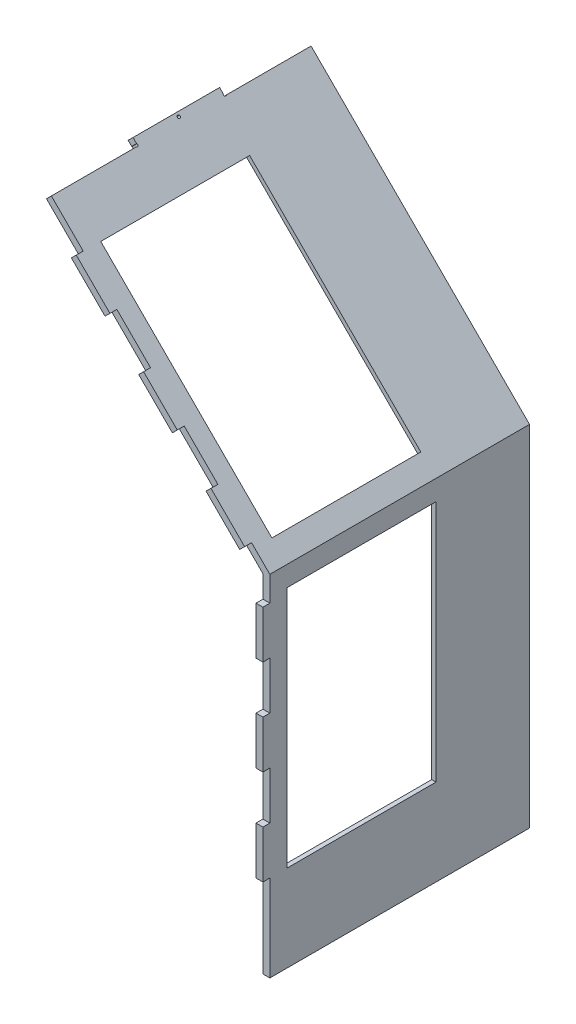
from build123d import *

# Parameters (mm, degrees)
BOSS_EXTRU_1_DEPTH      = 308
ESQUISSE2_W             = 8
ESQUISSE2_H             = 100
ESQUISSE2_H_2           = 55
ENL_V_MAT_EXTRU_1_DEPTH = 8
ESQUISSE3_W             = 172
ESQUISSE3_H             = 280.536291501
ENL_V_MAT_EXTRU_2_DEPTH = 532
ESQUISSE4_R             = 1.6
ESQUISSE4_W             = 172
ESQUISSE4_H             = 279.620784643
ENL_V_MAT_EXTRU_3_DEPTH = 8
ESQUISSE5_W             = 182
ESQUISSE5_H             = 290.536291501
ENL_V_MAT_EXTRU_4_DEPTH = 3
ESQUISSE6_W             = 182
ESQUISSE6_H             = 290
ENL_V_MAT_EXTRU_5_DEPTH = 3
ESQUISSE7_R             = 4
ENL_V_MAT_EXTRU_6_DEPTH = 5.3
ESQUISSE8_W             = 8.5
ESQUISSE8_H             = 406.733495256
ENL_V_MAT_EXTRU_7_DEPTH = 4
ESQUISSE9_W             = 8.5
ESQUISSE9_H             = 359.311541269
ENL_V_MAT_EXTRU_8_DEPTH = 4


with BuildPart() as part:
    # Esquisse1 → Boss.-Extru.1 (new body)
    with BuildSketch(Plane.XY):
        Polygon((-49.970813456, -41.917379116), (-57.970813456, -41.917379116), (-57.970813456, 358.618912385), (-313.627667703, 614.275766632), (-307.970813453, 619.932620882), (-49.970813456, 361.932620884), align=None)
    extrude(amount=BOSS_EXTRU_1_DEPTH)

    # Esquisse2 → Enlèv. mat.-Extru.1 (cut)
    with BuildSketch(Plane.XY.offset(308)):
        with Locations((-53.970813456, 8.082620884)):
            Rectangle(ESQUISSE2_W, ESQUISSE2_H)
        Polygon((-271.201260832, 571.849359761), (-265.544406582, 577.506214011), (-307.970813453, 619.932620882), (-313.627667703, 614.275766632), align=None)
        with Locations((-53.970813456, 140.582620884)):
            Rectangle(ESQUISSE2_W, ESQUISSE2_H_2)
        with Locations((-53.970813456, 250.582620884)):
            Rectangle(ESQUISSE2_W, ESQUISSE2_H_2)
        Polygon((-232.310387866, 532.958486796), (-226.653533617, 538.615341045), (-187.762660652, 499.72446808), (-193.419514901, 494.067613831), align=None)
        Polygon((-154.528641936, 455.176740865), (-148.871787686, 460.833595115), (-109.980914721, 421.94272215), (-115.637768971, 416.2858679), align=None)
        Polygon((-76.746896005, 377.394994935), (-71.090041756, 383.051849184), (-49.970813456, 361.932620884), (-49.970813456, 333.082620884), (-57.970813456, 333.082620884), (-57.970813456, 358.618912385), align=None)
    extrude(amount=-ENL_V_MAT_EXTRU_1_DEPTH, mode=Mode.SUBTRACT)

    # Esquisse3 → Enlèv. mat.-Extru.2 (cut)
    with BuildSketch(Plane.ZY.offset(57.970813456)):
        with Locations((194, 198.350766635)):
            Rectangle(ESQUISSE3_W, ESQUISSE3_H)
    extrude(amount=-ENL_V_MAT_EXTRU_2_DEPTH, mode=Mode.SUBTRACT)

    # Esquisse4 → Enlèv. mat.-Extru.3 (cut)
    with BuildSketch(Plane(origin=(155.980903714, 155.980903714, 0), x_dir=(0, 0, -1), z_dir=(0.707106781186556, 0.7071067811865391, 0))):
        with Locations(Location((-150, 652.126810705, 0), (0, 0, 90))):
            Circle(ESQUISSE4_R)
        with BuildLine():
            Line((-202.2627417, 648.126810705), (-300, 648.126810705))
            Line((-300, 648.126810705), (-300, 656.126810705))
            Line((-300, 656.126810705), (-200, 656.126810705))
            Line((-200, 656.126810705), (-200, 650.389552405))
            ThreePointArc((-200, 650.389552405), (-200, 648.126810705), (-202.2627417, 648.126810705))
        make_face()
        with BuildLine():
            Line((-100, 656.126810705), (-100, 650.389552405))
            ThreePointArc((-100, 650.389552405), (-100, 648.126810705), (-97.7372583, 648.126810705))
            Line((-97.7372583, 648.126810705), (0, 648.126810705))
            Line((0, 648.126810705), (0, 656.126810705))
            Line((0, 656.126810705), (-100, 656.126810705))
        make_face()
        with Locations((-194, 455.937203027)):
            Rectangle(ESQUISSE4_W, ESQUISSE4_H)
    extrude(amount=-ENL_V_MAT_EXTRU_3_DEPTH, mode=Mode.SUBTRACT)

    # Esquisse5 → Enlèv. mat.-Extru.4 (cut)
    with BuildSketch(Plane.ZY.offset(57.970813456)):
        with Locations((194, 198.350766635)):
            Rectangle(ESQUISSE5_W, ESQUISSE5_H)
    extrude(amount=-ENL_V_MAT_EXTRU_4_DEPTH, mode=Mode.SUBTRACT)

    # Esquisse6 → Enlèv. mat.-Extru.5 (cut)
    with BuildSketch(Plane(origin=(150.324049465, 150.324049465, 0), x_dir=(0, 0, 1), z_dir=(-0.707106781186556, -0.7071067811865391, 0))):
        with Locations((194, 455.747595348)):
            Rectangle(ESQUISSE6_W, ESQUISSE6_H)
    extrude(amount=-ENL_V_MAT_EXTRU_5_DEPTH, mode=Mode.SUBTRACT)

    # Esquisse7 → Enlèv. mat.-Extru.6 (cut)
    with BuildSketch(Plane.ZY.offset(57.970813456)):
        with Locations((20, -21.917379116)):
            Circle(ESQUISSE7_R)
    extrude(amount=-ENL_V_MAT_EXTRU_6_DEPTH, mode=Mode.SUBTRACT)

    # Esquisse8 → Enlèv. mat.-Extru.7 (cut)
    with BuildSketch(Plane.ZY.offset(57.970813456)):
        with Locations((94.25, 157.026144561)):
            Rectangle(ESQUISSE8_W, ESQUISSE8_H)
    extrude(amount=-ENL_V_MAT_EXTRU_7_DEPTH, mode=Mode.SUBTRACT)

    # Esquisse9 → Enlèv. mat.-Extru.8 (cut)
    with BuildSketch(Plane(origin=(150.324049465, 150.324049465, 0), x_dir=(0, 0, 1), z_dir=(-0.7071067811865559, -0.7071067811865391, 0))):
        with Locations((94.25, 472.802749855)):
            Rectangle(ESQUISSE9_W, ESQUISSE9_H)
    extrude(amount=-ENL_V_MAT_EXTRU_8_DEPTH, mode=Mode.SUBTRACT)


solid = part.part
